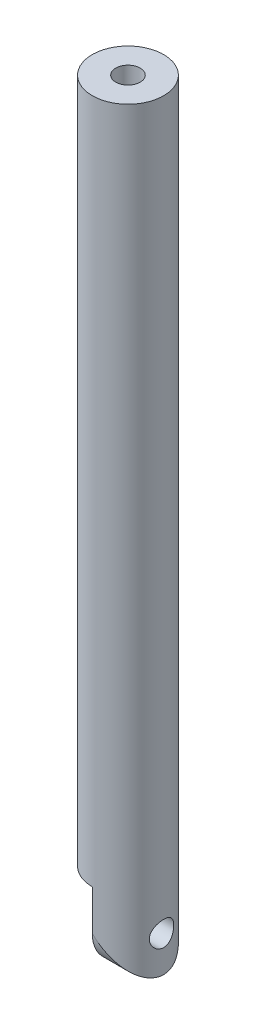
from build123d import *

# Parameters (mm, degrees)
CROQUIS1_R                     = 9.525
SALIENTE_EXTRUIR1_DEPTH        = 101.6
CROQUIS2_W                     = 19.05
CROQUIS2_H                     = 20.32
CORTAR_EXTRUIR1_DEPTH          = 12.7
CORTAR_EXTRUIR2_DEPTH          = 12.7
TALADRO_ROSCADO_5_16_181_D     = 6.5278
TALADRO_ROSCADO_5_16_181_DEPTH = 22.9235
TALADRO_ROSCADO_5_16_181_TIP   = 1.961148974
TALADRO_ROSCADO_5_16_182_D     = 6.5278
TALADRO_ROSCADO_5_16_182_DEPTH = 19.7485
TALADRO_ROSCADO_5_16_182_TIP   = 1.961148974


with BuildPart() as part:
    # Croquis1 → Saliente-Extruir1 (new, symmetric)
    with BuildSketch(Plane(origin=(0, 0, 0), x_dir=(1, 0, 0), z_dir=(0, 1, 0))):
        with Locations(Location((0, 0, 0), (0, 0, 270))):
            Circle(CROQUIS1_R)
    extrude(amount=SALIENTE_EXTRUIR1_DEPTH, both=True)

    # Croquis2 → Cortar-Extruir1 (cut)
    with BuildSketch(Plane(origin=(0, 0, 0), x_dir=(0, 0, -1), z_dir=(1, 0, 0))):
        with Locations((0, -91.44)):
            Rectangle(CROQUIS2_W, CROQUIS2_H)
    extrude(amount=-CORTAR_EXTRUIR1_DEPTH, mode=Mode.SUBTRACT)

    # Croquis3 → Cortar-Extruir2 (cut)
    with BuildSketch(Plane.ZY):
        with BuildLine():
            ThreePointArc((0, -101.6), (-6.735192091, -98.810192091), (-9.525, -92.075))
            Line((-9.525, -92.075), (-9.525, -101.6))
            Line((-9.525, -101.6), (0, -101.6))
        make_face()
        with BuildLine():
            ThreePointArc((9.525, -92.075), (6.735192091, -98.810192091), (0, -101.6))
            Line((0, -101.6), (9.525, -101.6))
            Line((9.525, -101.6), (9.525, -92.075))
        make_face()
    extrude(amount=-CORTAR_EXTRUIR2_DEPTH, mode=Mode.SUBTRACT)

    # Taladro roscado 5/16-181
    with Locations(Plane.ZY):
        with Locations((0, -92.075)):
            Hole(TALADRO_ROSCADO_5_16_181_D / 2, depth=TALADRO_ROSCADO_5_16_181_DEPTH)
            with Locations((0, 0, -(TALADRO_ROSCADO_5_16_181_DEPTH + TALADRO_ROSCADO_5_16_181_TIP / 2))):  # 118° drill point
                Cone(0, TALADRO_ROSCADO_5_16_181_D / 2, TALADRO_ROSCADO_5_16_181_TIP, mode=Mode.SUBTRACT)

    # Taladro roscado 5/16-182
    with Locations(Plane(origin=(0, 101.6, 0), x_dir=(1, 0, 0), z_dir=(0, 1, 0))):
        with Locations((0, 0)):
            Hole(TALADRO_ROSCADO_5_16_182_D / 2, depth=TALADRO_ROSCADO_5_16_182_DEPTH)
            with Locations((0, 0, -(TALADRO_ROSCADO_5_16_182_DEPTH + TALADRO_ROSCADO_5_16_182_TIP / 2))):  # 118° drill point
                Cone(0, TALADRO_ROSCADO_5_16_182_D / 2, TALADRO_ROSCADO_5_16_182_TIP, mode=Mode.SUBTRACT)


solid = part.part
